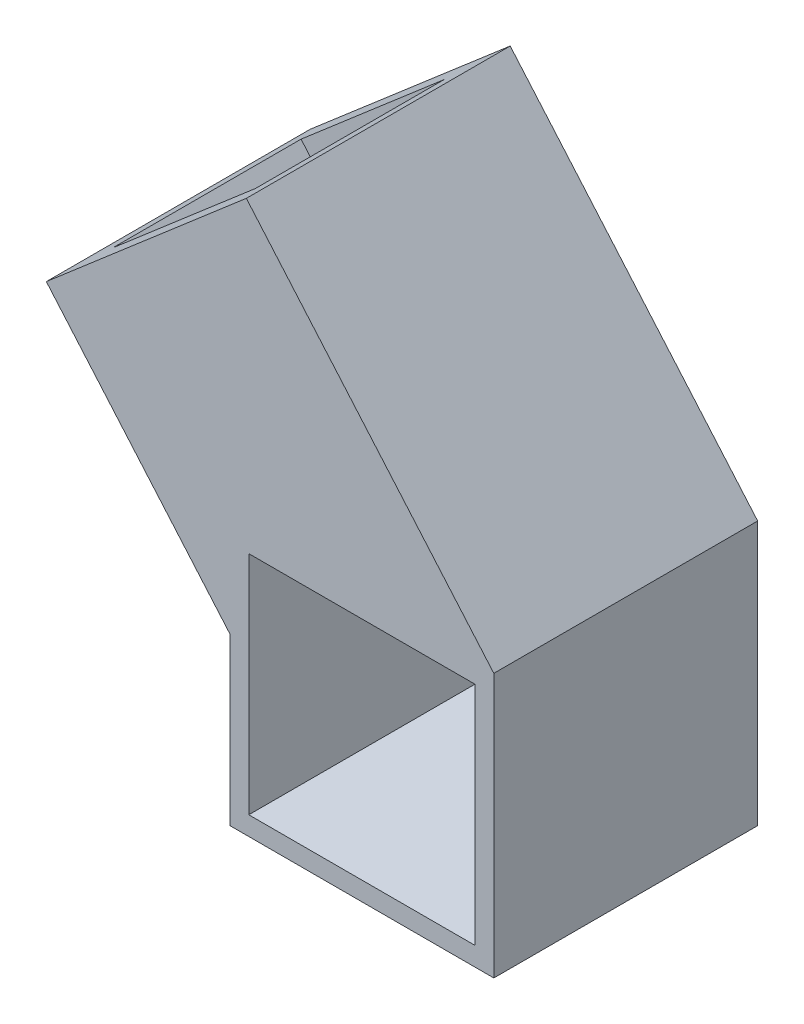
from build123d import *

# Parameters (mm, degrees)
SKETCH_1_W          = 14
SKETCH_1_H          = 14
SKETCH_1_W_2        = 12
SKETCH_1_H_2        = 12
EXTRUDE_1_DEPTH     = 14
EXTRUDE_3_DEPTH     = 14
SKETCH_3_W          = 10
SKETCH_3_H          = 10
CUT_EXTRUDE_1_DEPTH = 10


with BuildPart() as part:
    # 草图1 → 凸台-拉伸1 (new body)
    with BuildSketch(Plane.XY):
        with Locations((7, 7)):
            Rectangle(SKETCH_1_W, SKETCH_1_H)
        with Locations((7, 7)):
            Rectangle(SKETCH_1_W_2, SKETCH_1_H_2, mode=Mode.SUBTRACT)
    extrude(amount=EXTRUDE_1_DEPTH)

    # 草图2 → 凸台-拉伸3 (add)
    with BuildSketch(Plane(origin=(0, 0, 0), x_dir=(-1, 0, 0), z_dir=(0, 0, -1))):
        Polygon((-0.869466018, 29.259809863), (-8.044126787, 20.92169), (0, 14), (2.568025419, 11.790303866), (9.742686188, 20.128423729), align=None)
        Polygon((-13.999999155, 14), (-8.044126787, 20.92169), (0, 14), align=None)
        Polygon((2.568025419, 11.790303866), (0, 14), (0, 8.805841681), align=None)
    extrude(amount=-EXTRUDE_3_DEPTH)

    # 草图3 → 切除-拉伸1 (cut)
    with BuildSketch(Plane(origin=(-14.096351186, 16.382247136, 0), x_dir=(0.75801089666448, 0.6522418880583423, 0), z_dir=(-0.6522418880583423, 0.75801089666448, 0))):
        with Locations((12.743538804, -7)):
            Rectangle(SKETCH_3_W, SKETCH_3_H)
    extrude(amount=-CUT_EXTRUDE_1_DEPTH, mode=Mode.SUBTRACT)


solid = part.part
